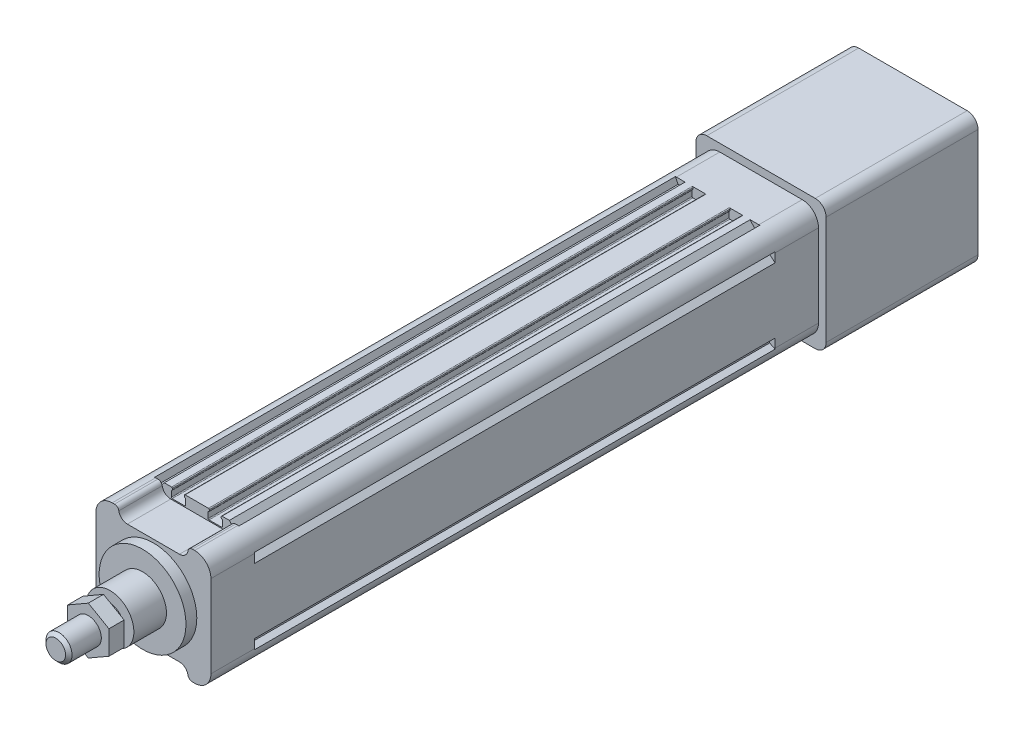
from build123d import *

# Parameters (mm, degrees)
SKETCH_1_R             = 2.1
EXTRUDE_1_DEPTH        = 240
EXTRUDE_2_DEPTH        = 20
SKETCH_7_R             = 20
EXTRUDE_3_DEPTH        = 5
SKETCH_9_R             = 11
EXTRUDE_4_DEPTH        = 15
SKETCH_10_R            = 6
EXTRUDE_5_DEPTH        = 25
EXTRUDE_START          = 20
EXTRUDE_6_DEPTH        = 20
EXTRUDE_7_DEPTH        = 70
SKETCH_14_R            = 19
CUT_EXTRUDE_2_DEPTH    = 70
HOLE_WIZARD_M6_1_D     = 5
HOLE_WIZARD_M6_1_DEPTH = 15
HOLE_WIZARD_M6_1_TIP   = 1.502151548
CHAMFER_1_SIZE         = 1.5
EXTRUDE_START_2        = 3
EXTRUDE_8_DEPTH        = 7


with BuildPart() as part:
    # 草图1 → 凸台-拉伸1 (new body)
    with BuildSketch(Plane.XY):
        with BuildLine():
            Line((-18.2, 24), (-19.443439638, 26.486879276))
            ThreePointArc((-19.443439638, 26.486879276), (-24.303300859, 24.303300859), (-26.486879276, 19.443439638))
            Line((-26.486879276, 19.443439638), (-24, 18.2))
            Line((-24, 18.2), (-24, 17.1))
            Line((-24, 17.1), (-26.5, 15))
            Line((-26.5, 15), (-26.5, -15))
            Line((-26.5, -15), (-24, -17.1))
            Line((-24, -17.1), (-24, -18.2))
            Line((-24, -18.2), (-26.486879276, -19.443439638))
            ThreePointArc((-26.486879276, -19.443439638), (-24.303300859, -24.303300859), (-19.443439638, -26.486879276))
            Line((-19.443439638, -26.486879276), (-18.2, -24))
            Line((-18.2, -24), (-17.1, -24))
            Line((-17.1, -24), (-15, -26.5))
            Line((-15, -26.5), (-11.65, -26.5))
            ThreePointArc((-11.65, -26.5), (-11.367157288, -26.382842712), (-11.25, -26.1))
            Line((-11.25, -26.1), (-11.25, -25.6))
            ThreePointArc((-11.25, -25.6), (-11.367157288, -25.317157288), (-11.65, -25.2))
            Line((-11.65, -25.2), (-11.75, -25.2))
            Line((-11.75, -25.2), (-11.75, -22.4))
            ThreePointArc((-11.75, -22.4), (-11.632842712, -22.117157288), (-11.35, -22))
            Line((-11.35, -22), (-5.65, -22))
            ThreePointArc((-5.65, -22), (-5.367157288, -22.117157288), (-5.25, -22.4))
            Line((-5.25, -22.4), (-5.25, -25.2))
            Line((-5.25, -25.2), (-5.35, -25.2))
            ThreePointArc((-5.35, -25.2), (-5.632842712, -25.317157288), (-5.75, -25.6))
            Line((-5.75, -25.6), (-5.75, -26.1))
            ThreePointArc((-5.75, -26.1), (-5.632842712, -26.382842712), (-5.35, -26.5))
            Line((-5.35, -26.5), (5.35, -26.5))
            ThreePointArc((5.35, -26.5), (5.632842712, -26.382842712), (5.75, -26.1))
            Line((5.75, -26.1), (5.75, -25.6))
            ThreePointArc((5.75, -25.6), (5.632842712, -25.317157288), (5.35, -25.2))
            Line((5.35, -25.2), (5.25, -25.2))
            Line((5.25, -25.2), (5.25, -22.4))
            ThreePointArc((5.25, -22.4), (5.367157288, -22.117157288), (5.65, -22))
            Line((5.65, -22), (11.35, -22))
            ThreePointArc((11.35, -22), (11.632842712, -22.117157288), (11.75, -22.4))
            Line((11.75, -22.4), (11.75, -25.2))
            Line((11.75, -25.2), (11.65, -25.2))
            ThreePointArc((11.65, -25.2), (11.367157288, -25.317157288), (11.25, -25.6))
            Line((11.25, -25.6), (11.25, -26.1))
            ThreePointArc((11.25, -26.1), (11.367157288, -26.382842712), (11.65, -26.5))
            Line((11.65, -26.5), (15, -26.5))
            Line((15, -26.5), (17.1, -24))
            Line((17.1, -24), (18.2, -24))
            Line((18.2, -24), (19.443439638, -26.486879276))
            ThreePointArc((19.443439638, -26.486879276), (24.303300859, -24.303300859), (26.486879276, -19.443439638))
            Line((26.486879276, -19.443439638), (24, -18.2))
            Line((24, -18.2), (24, -17.1))
            Line((24, -17.1), (26.5, -15))
            Line((26.5, -15), (26.5, 15))
            Line((26.5, 15), (24, 17.1))
            Line((24, 17.1), (24, 18.2))
            Line((24, 18.2), (26.486879276, 19.443439638))
            ThreePointArc((26.486879276, 19.443439638), (24.303300859, 24.303300859), (19.443439638, 26.486879276))
            Line((19.443439638, 26.486879276), (18.2, 24))
            Line((18.2, 24), (17.1, 24))
            Line((17.1, 24), (15, 26.5))
            Line((15, 26.5), (11.65, 26.5))
            ThreePointArc((11.65, 26.5), (11.367157288, 26.382842712), (11.25, 26.1))
            Line((11.25, 26.1), (11.25, 25.6))
            ThreePointArc((11.25, 25.6), (11.367157288, 25.317157288), (11.65, 25.2))
            Line((11.65, 25.2), (11.75, 25.2))
            Line((11.75, 25.2), (11.75, 22.4))
            ThreePointArc((11.75, 22.4), (11.632842712, 22.117157288), (11.35, 22))
            Line((11.35, 22), (5.65, 22))
            ThreePointArc((5.65, 22), (5.367157288, 22.117157288), (5.25, 22.4))
            Line((5.25, 22.4), (5.25, 25.2))
            Line((5.25, 25.2), (5.35, 25.2))
            ThreePointArc((5.35, 25.2), (5.632842712, 25.317157288), (5.75, 25.6))
            Line((5.75, 25.6), (5.75, 26.1))
            ThreePointArc((5.75, 26.1), (5.632842712, 26.382842712), (5.35, 26.5))
            Line((5.35, 26.5), (-5.35, 26.5))
            ThreePointArc((-5.35, 26.5), (-5.632842712, 26.382842712), (-5.75, 26.1))
            Line((-5.75, 26.1), (-5.75, 25.6))
            ThreePointArc((-5.75, 25.6), (-5.632842712, 25.317157288), (-5.35, 25.2))
            Line((-5.35, 25.2), (-5.25, 25.2))
            Line((-5.25, 25.2), (-5.25, 22.4))
            ThreePointArc((-5.25, 22.4), (-5.367157288, 22.117157288), (-5.65, 22))
            Line((-5.65, 22), (-11.35, 22))
            ThreePointArc((-11.35, 22), (-11.632842712, 22.117157288), (-11.75, 22.4))
            Line((-11.75, 22.4), (-11.75, 25.2))
            Line((-11.75, 25.2), (-11.65, 25.2))
            ThreePointArc((-11.65, 25.2), (-11.367157288, 25.317157288), (-11.25, 25.6))
            Line((-11.25, 25.6), (-11.25, 26.1))
            ThreePointArc((-11.25, 26.1), (-11.367157288, 26.382842712), (-11.65, 26.5))
            Line((-11.65, 26.5), (-15, 26.5))
            Line((-15, 26.5), (-17.1, 24))
            Line((-17.1, 24), (-18.2, 24))
        make_face()
        with Locations((19, 19)):
            Circle(SKETCH_1_R, mode=Mode.SUBTRACT)
        with Locations((19, -19)):
            Circle(SKETCH_1_R, mode=Mode.SUBTRACT)
        with Locations((-19, -19)):
            Circle(SKETCH_1_R, mode=Mode.SUBTRACT)
        with Locations((-19, 19)):
            Circle(SKETCH_1_R, mode=Mode.SUBTRACT)
        with BuildLine():
            Line((19.773719933, 3), (23.3, 3))
            Line((23.3, 3), (23.3, -3))
            Line((23.3, -3), (19.773719933, -3))
            ThreePointArc((19.773719933, -3), (0, -20), (-19.773719933, -3))
            Line((-19.773719933, -3), (-23.3, -3))
            Line((-23.3, -3), (-23.3, 3))
            Line((-23.3, 3), (-19.773719933, 3))
            ThreePointArc((-19.773719933, 3), (0, 20), (19.773719933, 3))
        make_face(mode=Mode.SUBTRACT)
    extrude(amount=EXTRUDE_1_DEPTH)

    # 草图6 → 凸台-拉伸2 (add)
    with BuildSketch(Plane.XY.offset(240)):
        with BuildLine():
            Line((-26.5, -19), (-26.5, 19))
            ThreePointArc((-26.5, 19), (-24.303300859, 24.303300859), (-19, 26.5))
            Line((-19, 26.5), (-17.916079783, 26.5))
            ThreePointArc((-17.916079783, 26.5), (-16.625085334, 26.027525232), (-15.944053189, 24.833333333))
            ThreePointArc((-15.944053189, 24.833333333), (-14.581988897, 22.444949537), (-12, 21.5))
            Line((-12, 21.5), (12, 21.5))
            ThreePointArc((12, 21.5), (14.581988897, 22.444949537), (15.944053189, 24.833333333))
            ThreePointArc((15.944053189, 24.833333333), (16.625085334, 26.027525232), (17.916079783, 26.5))
            Line((17.916079783, 26.5), (19, 26.5))
            ThreePointArc((19, 26.5), (24.303300859, 24.303300859), (26.5, 19))
            Line((26.5, 19), (26.5, -19))
            ThreePointArc((26.5, -19), (24.303300859, -24.303300859), (19, -26.5))
            Line((19, -26.5), (17.916079783, -26.5))
            ThreePointArc((17.916079783, -26.5), (16.625085334, -26.027525232), (15.944053189, -24.833333333))
            ThreePointArc((15.944053189, -24.833333333), (14.581988897, -22.444949537), (12, -21.5))
            Line((12, -21.5), (-12, -21.5))
            ThreePointArc((-12, -21.5), (-14.581988897, -22.444949537), (-15.944053189, -24.833333333))
            ThreePointArc((-15.944053189, -24.833333333), (-16.625085334, -26.027525232), (-17.916079783, -26.5))
            Line((-17.916079783, -26.5), (-19, -26.5))
            ThreePointArc((-19, -26.5), (-24.303300859, -24.303300859), (-26.5, -19))
        make_face()
    extrude(amount=EXTRUDE_2_DEPTH)

    # 草图7 → 凸台-拉伸3 (add)
    with BuildSketch(Plane.XY.offset(260)):
        Circle(SKETCH_7_R)
    extrude(amount=EXTRUDE_3_DEPTH)

    # 草图9 → 凸台-拉伸4 (add)
    with BuildSketch(Plane.XY.offset(265)):
        Circle(SKETCH_9_R)
    extrude(amount=EXTRUDE_4_DEPTH)

    # 草图10 → 凸台-拉伸5 (add)
    with BuildSketch(Plane.XY.offset(280)):
        Circle(SKETCH_10_R)
    extrude(amount=EXTRUDE_5_DEPTH)

    # 草图11 → 凸台-拉伸6 (add)
    with BuildSketch(Plane(origin=(0, 0, 0), x_dir=(-1, 0, 0), z_dir=(0, 0, -1)).offset(EXTRUDE_START)):
        with BuildLine():
            Line((-19, -26.5), (19, -26.5))
            ThreePointArc((19, -26.5), (24.303300859, -24.303300859), (26.5, -19))
            Line((26.5, -19), (26.5, 19))
            ThreePointArc((26.5, 19), (24.303300859, 24.303300859), (19, 26.5))
            Line((19, 26.5), (-19, 26.5))
            ThreePointArc((-19, 26.5), (-24.303300859, 24.303300859), (-26.5, 19))
            Line((-26.5, 19), (-26.5, -19))
            ThreePointArc((-26.5, -19), (-24.303300859, -24.303300859), (-19, -26.5))
        make_face()
    extrude(amount=-EXTRUDE_6_DEPTH)

    # 草图12 → 凸台-拉伸7 (add)
    with BuildSketch(Plane(origin=(0, 0, -20), x_dir=(-1, 0, 0), z_dir=(0, 0, -1))):
        with BuildLine():
            Line((-25, -30), (25, -30))
            ThreePointArc((25, -30), (28.535533906, -28.535533906), (30, -25))
            Line((30, -25), (30, 25))
            ThreePointArc((30, 25), (28.535533906, 28.535533906), (25, 30))
            Line((25, 30), (-25, 30))
            ThreePointArc((-25, 30), (-28.535533906, 28.535533906), (-30, 25))
            Line((-30, 25), (-30, -25))
            ThreePointArc((-30, -25), (-28.535533906, -28.535533906), (-25, -30))
        make_face()
    extrude(amount=EXTRUDE_7_DEPTH)

    # 草图14 → 切除-拉伸2 (cut)
    with BuildSketch(Plane(origin=(0, 0, -90), x_dir=(-1, 0, 0), z_dir=(0, 0, -1))):
        Circle(SKETCH_14_R)
    extrude(amount=-CUT_EXTRUDE_2_DEPTH, mode=Mode.SUBTRACT)

    # M6 螺纹孔1
    with Locations(Plane.ZY.offset(26.5)):
        with Locations((250, 11), (250, -11), (-10, 11), (-10, -11)):
            Hole(HOLE_WIZARD_M6_1_D / 2, depth=HOLE_WIZARD_M6_1_DEPTH)
            with Locations((0, 0, -(HOLE_WIZARD_M6_1_DEPTH + HOLE_WIZARD_M6_1_TIP / 2))):  # 118° drill point
                Cone(0, HOLE_WIZARD_M6_1_D / 2, HOLE_WIZARD_M6_1_TIP, mode=Mode.SUBTRACT)

    # 倒角1
    chamfer_1_edges = [part.edges().sort_by_distance(p)[0] for p in [
        (-6, 0, 305),
    ]]
    chamfer(chamfer_1_edges, length=CHAMFER_1_SIZE)

    # 草图17 → 凸台-拉伸8 (add)
    with BuildSketch(Plane.XY.offset(280).offset(EXTRUDE_START_2)):
        Polygon((0, 10.969655115), (-9.5, 5.484827557), (-9.5, -5.484827557), (0, -10.969655115), (9.5, -5.484827557), (9.5, 5.484827557), align=None)
    extrude(amount=EXTRUDE_8_DEPTH)


solid = part.part
